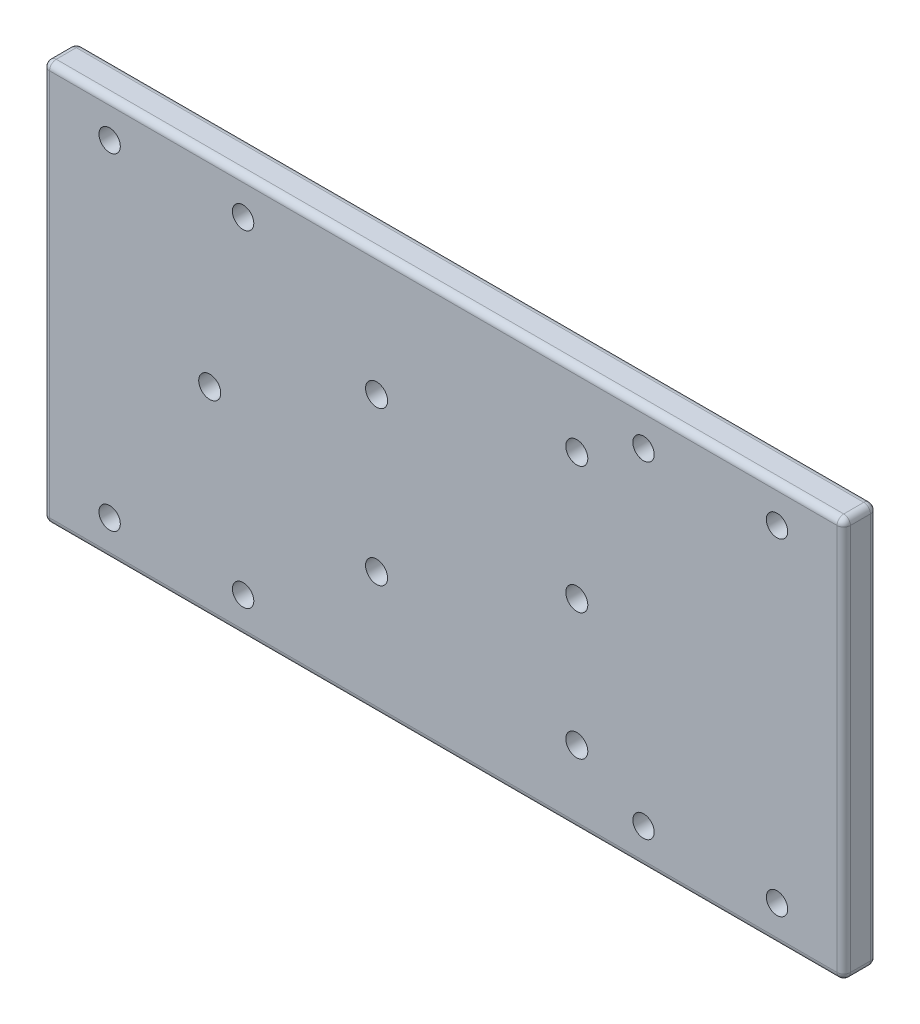
from build123d import *

# Parameters (mm, degrees)
SKETCH_1_W          = 120
SKETCH_1_H          = 60
EXTRUDE_1_DEPTH     = 5
CUT_EXTRUDE_1_REACH = 115.997
SKETCH_2_R          = 1.65
CUT_EXTRUDE_2_REACH = 115.997
SKETCH_4_R          = 1.6
CUT_EXTRUDE_3_REACH = 115.997
SKETCH_5_R          = 1.65
FILLET_1_R          = 1


with BuildPart() as part:
    # 草图1 → 凸台-拉伸1 (new body)
    with BuildSketch(Plane.XY):
        with Locations((-40, -24.5)):
            Rectangle(SKETCH_1_W, SKETCH_1_H)
    extrude(amount=EXTRUDE_1_DEPTH)

    # 草图2 → 切除-拉伸1 (cut, up to next)
    with BuildSketch(Plane.XY.offset(5), mode=Mode.PRIVATE) as cut_extrude_1_sk1:
        with Locations((-50, -13)):
            Circle(SKETCH_2_R)
    cut_extrude_1_tool1 = extrude(cut_extrude_1_sk1.sketch, amount=-CUT_EXTRUDE_1_REACH, mode=Mode.PRIVATE) & part.part
    # 草图2 → 切除-拉伸1 (cut, up to next)
    with BuildSketch(Plane.XY.offset(5), mode=Mode.PRIVATE) as cut_extrude_1_sk2:
        with Locations((-75, -24.5)):
            Circle(SKETCH_2_R)
    cut_extrude_1_tool2 = extrude(cut_extrude_1_sk2.sketch, amount=-CUT_EXTRUDE_1_REACH, mode=Mode.PRIVATE) & part.part
    # 草图2 → 切除-拉伸1 (cut, up to next)
    with BuildSketch(Plane.XY.offset(5), mode=Mode.PRIVATE) as cut_extrude_1_sk3:
        with Locations((-50, -36)):
            Circle(SKETCH_2_R)
    cut_extrude_1_tool3 = extrude(cut_extrude_1_sk3.sketch, amount=-CUT_EXTRUDE_1_REACH, mode=Mode.PRIVATE) & part.part
    add(cut_extrude_1_tool1.solids().sort_by_distance((-50, -13, 5))[0], mode=Mode.SUBTRACT)
    add(cut_extrude_1_tool2.solids().sort_by_distance((-75, -24.5, 5))[0], mode=Mode.SUBTRACT)
    add(cut_extrude_1_tool3.solids().sort_by_distance((-50, -36, 5))[0], mode=Mode.SUBTRACT)

    # 草图4 → 切除-拉伸2 (cut, up to next)
    with BuildSketch(Plane(origin=(0, 0, 0), x_dir=(-1, 0, 0), z_dir=(0, 0, -1)), mode=Mode.PRIVATE) as cut_extrude_2_sk1:
        with Locations((90, 0)):
            Circle(SKETCH_4_R)
    cut_extrude_2_tool1 = extrude(cut_extrude_2_sk1.sketch, amount=-CUT_EXTRUDE_2_REACH, mode=Mode.PRIVATE) & part.part
    # 草图4 → 切除-拉伸2 (cut, up to next)
    with BuildSketch(Plane(origin=(0, 0, 0), x_dir=(-1, 0, 0), z_dir=(0, 0, -1)), mode=Mode.PRIVATE) as cut_extrude_2_sk2:
        with Locations((70, 0)):
            Circle(SKETCH_4_R)
    cut_extrude_2_tool2 = extrude(cut_extrude_2_sk2.sketch, amount=-CUT_EXTRUDE_2_REACH, mode=Mode.PRIVATE) & part.part
    # 草图4 → 切除-拉伸2 (cut, up to next)
    with BuildSketch(Plane(origin=(0, 0, 0), x_dir=(-1, 0, 0), z_dir=(0, 0, -1)), mode=Mode.PRIVATE) as cut_extrude_2_sk3:
        with Locations((70, -49)):
            Circle(SKETCH_4_R)
    cut_extrude_2_tool3 = extrude(cut_extrude_2_sk3.sketch, amount=-CUT_EXTRUDE_2_REACH, mode=Mode.PRIVATE) & part.part
    # 草图4 → 切除-拉伸2 (cut, up to next)
    with BuildSketch(Plane(origin=(0, 0, 0), x_dir=(-1, 0, 0), z_dir=(0, 0, -1)), mode=Mode.PRIVATE) as cut_extrude_2_sk4:
        with Locations((90, -49)):
            Circle(SKETCH_4_R)
    cut_extrude_2_tool4 = extrude(cut_extrude_2_sk4.sketch, amount=-CUT_EXTRUDE_2_REACH, mode=Mode.PRIVATE) & part.part
    # 草图4 → 切除-拉伸2 (cut, up to next)
    with BuildSketch(Plane(origin=(0, 0, 0), x_dir=(-1, 0, 0), z_dir=(0, 0, -1)), mode=Mode.PRIVATE) as cut_extrude_2_sk5:
        with Locations((10, -49)):
            Circle(SKETCH_4_R)
    cut_extrude_2_tool5 = extrude(cut_extrude_2_sk5.sketch, amount=-CUT_EXTRUDE_2_REACH, mode=Mode.PRIVATE) & part.part
    # 草图4 → 切除-拉伸2 (cut, up to next)
    with BuildSketch(Plane(origin=(0, 0, 0), x_dir=(-1, 0, 0), z_dir=(0, 0, -1)), mode=Mode.PRIVATE) as cut_extrude_2_sk6:
        with Locations((-10, -49)):
            Circle(SKETCH_4_R)
    cut_extrude_2_tool6 = extrude(cut_extrude_2_sk6.sketch, amount=-CUT_EXTRUDE_2_REACH, mode=Mode.PRIVATE) & part.part
    # 草图4 → 切除-拉伸2 (cut, up to next)
    with BuildSketch(Plane(origin=(0, 0, 0), x_dir=(-1, 0, 0), z_dir=(0, 0, -1)), mode=Mode.PRIVATE) as cut_extrude_2_sk7:
        with Locations((-10, 0)):
            Circle(SKETCH_4_R)
    cut_extrude_2_tool7 = extrude(cut_extrude_2_sk7.sketch, amount=-CUT_EXTRUDE_2_REACH, mode=Mode.PRIVATE) & part.part
    # 草图4 → 切除-拉伸2 (cut, up to next)
    with BuildSketch(Plane(origin=(0, 0, 0), x_dir=(-1, 0, 0), z_dir=(0, 0, -1)), mode=Mode.PRIVATE) as cut_extrude_2_sk8:
        with Locations((10, 0)):
            Circle(SKETCH_4_R)
    cut_extrude_2_tool8 = extrude(cut_extrude_2_sk8.sketch, amount=-CUT_EXTRUDE_2_REACH, mode=Mode.PRIVATE) & part.part
    add(cut_extrude_2_tool1.solids().sort_by_distance((-90, 0, 0))[0], mode=Mode.SUBTRACT)
    add(cut_extrude_2_tool2.solids().sort_by_distance((-70, 0, 0))[0], mode=Mode.SUBTRACT)
    add(cut_extrude_2_tool3.solids().sort_by_distance((-70, -49, 0))[0], mode=Mode.SUBTRACT)
    add(cut_extrude_2_tool4.solids().sort_by_distance((-90, -49, 0))[0], mode=Mode.SUBTRACT)
    add(cut_extrude_2_tool5.solids().sort_by_distance((-10, -49, 0))[0], mode=Mode.SUBTRACT)
    add(cut_extrude_2_tool6.solids().sort_by_distance((10, -49, 0))[0], mode=Mode.SUBTRACT)
    add(cut_extrude_2_tool7.solids().sort_by_distance((10, 0, 0))[0], mode=Mode.SUBTRACT)
    add(cut_extrude_2_tool8.solids().sort_by_distance((-10, 0, 0))[0], mode=Mode.SUBTRACT)

    # 草图5 → 切除-拉伸3 (cut, up to next)
    with BuildSketch(Plane.XY.offset(5), mode=Mode.PRIVATE) as cut_extrude_3_sk1:
        with Locations((-20, -43.5)):
            Circle(SKETCH_5_R)
    cut_extrude_3_tool1 = extrude(cut_extrude_3_sk1.sketch, amount=-CUT_EXTRUDE_3_REACH, mode=Mode.PRIVATE) & part.part
    # 草图5 → 切除-拉伸3 (cut, up to next)
    with BuildSketch(Plane.XY.offset(5), mode=Mode.PRIVATE) as cut_extrude_3_sk2:
        with Locations((-20, -24.5)):
            Circle(SKETCH_5_R)
    cut_extrude_3_tool2 = extrude(cut_extrude_3_sk2.sketch, amount=-CUT_EXTRUDE_3_REACH, mode=Mode.PRIVATE) & part.part
    # 草图5 → 切除-拉伸3 (cut, up to next)
    with BuildSketch(Plane.XY.offset(5), mode=Mode.PRIVATE) as cut_extrude_3_sk3:
        with Locations((-20, -5.5)):
            Circle(SKETCH_5_R)
    cut_extrude_3_tool3 = extrude(cut_extrude_3_sk3.sketch, amount=-CUT_EXTRUDE_3_REACH, mode=Mode.PRIVATE) & part.part
    add(cut_extrude_3_tool1.solids().sort_by_distance((-20, -43.5, 5))[0], mode=Mode.SUBTRACT)
    add(cut_extrude_3_tool2.solids().sort_by_distance((-20, -24.5, 5))[0], mode=Mode.SUBTRACT)
    add(cut_extrude_3_tool3.solids().sort_by_distance((-20, -5.5, 5))[0], mode=Mode.SUBTRACT)

    # 圆角1
    fillet_1_edges = [part.edges().sort_by_distance(p)[0] for p in [
        (-100, -24.5, 5),
        (-40, -54.5, 5),
        (20, -24.5, 5),
        (-40, -54.5, 0),
        (-100, -24.5, 0),
        (-40, 5.5, 0),
        (20, -24.5, 0),
        (20, -54.5, 2.5),
        (-100, -54.5, 2.5),
        (-100, 5.5, 2.5),
        (20, 5.5, 2.5),
        (-40, 5.5, 5),
    ]]
    fillet(fillet_1_edges, radius=FILLET_1_R)


solid = part.part
